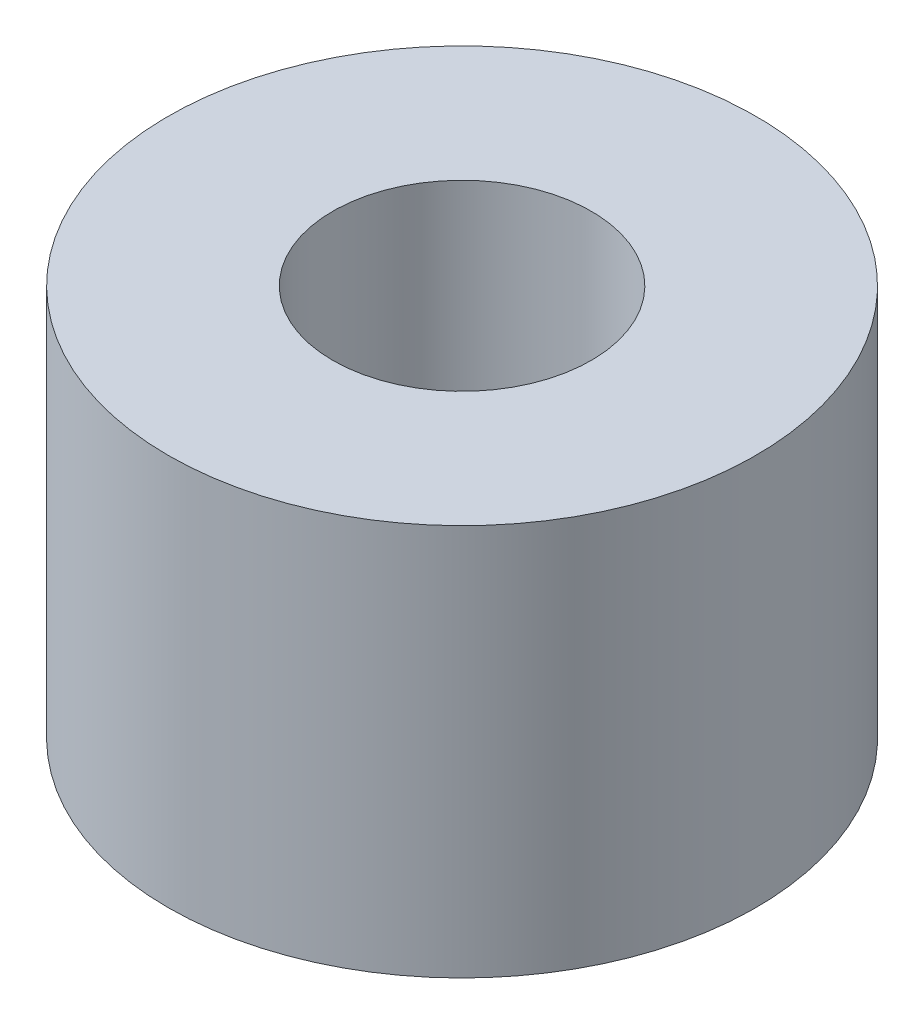
from build123d import *

# Parameters (mm, degrees)
SKETCH_1_R      = 3
SKETCH_1_R_2    = 1.32
EXTRUDE_1_DEPTH = 4


with BuildPart() as part:
    # Эскиз1 → Бобышка-Вытянуть1 (new body)
    with BuildSketch(Plane(origin=(0, 0, 0), x_dir=(1, 0, 0), z_dir=(0, 1, 0))):
        with Locations(Location((0, 0, 0), (0, 0, 270))):
            Circle(SKETCH_1_R)
        with Locations(Location((0, 0, 0), (0, 0, 270))):
            Circle(SKETCH_1_R_2, mode=Mode.SUBTRACT)
    extrude(amount=EXTRUDE_1_DEPTH)


solid = part.part
